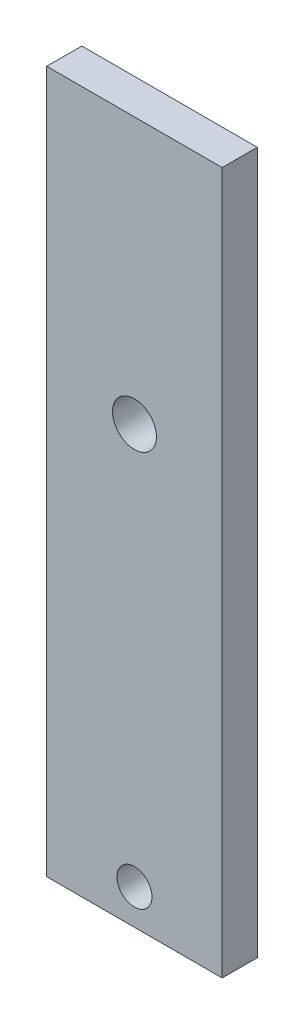
from build123d import *

# Parameters (mm, degrees)
SKETCH1_W             = 10
SKETCH1_H             = 40
BOSS_EXTRUDE1_DEPTH   = 2
M3X0_5_TAPPED_HOLE1_D = 2.5
CUT_EXTRUDE1_REACH    = 27.573
SKETCH6_R             = 1


with BuildPart() as part:
    # Sketch1 → Boss-Extrude1 (new body)
    with BuildSketch(Plane.XY):
        with Locations((0, -5)):
            Rectangle(SKETCH1_W, SKETCH1_H)
    extrude(amount=BOSS_EXTRUDE1_DEPTH)

    # M3x0.5 Tapped Hole1 (through all)
    with Locations(Plane.XY.offset(2)):
        with Locations((0, -0.164876805)):
            Hole(M3X0_5_TAPPED_HOLE1_D / 2)

    # Sketch6 → Cut-Extrude1 (cut, up to next)
    with BuildSketch(Plane.XY.offset(2), mode=Mode.PRIVATE) as cut_extrude1_sk1:
        with Locations((0, -23)):
            Circle(SKETCH6_R)
    cut_extrude1_tool1 = extrude(cut_extrude1_sk1.sketch, amount=-CUT_EXTRUDE1_REACH, mode=Mode.PRIVATE) & part.part
    add(cut_extrude1_tool1.solids().sort_by_distance((0, -23, 2))[0], mode=Mode.SUBTRACT)


solid = part.part
